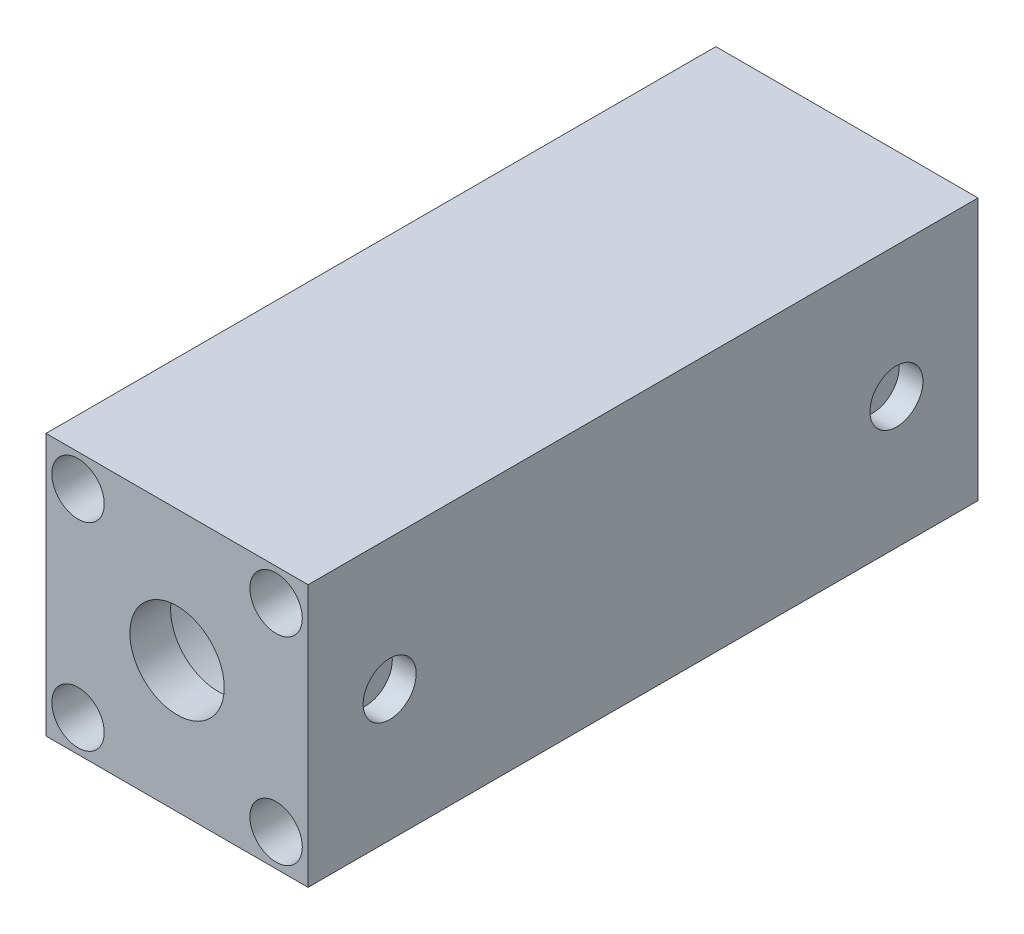
from build123d import *

# Parameters (mm, degrees)
SKETCH1_W                                      = 45
SKETCH1_H                                      = 45
SKETCH1_R                                      = 2.75
SKETCH1_R_2                                    = 16
SMC_45_MM_SQUARE_BODY_AND_FOUR_5_5_MM_TH_DEPTH = 115
SKETCH2_R                                      = 16
HEAD_END_CLEARANCE_ENVELOPE_DEPTH              = 7
ROD_START                                      = 108
SKETCH3_R                                      = 16
SKETCH3_R_2                                    = 8.1
ROD_COVER_AND_16_MM_ROD_CLEARANCE_DEPTH        = 7
SKETCH4_R                                      = 4.5
REAR_BOLT_HEAD_COUNTERBORES_DEPTH              = 7
FRONT_START                                    = 108
SKETCH5_R                                      = 4.5
FRONT_MOUNTING_COUNTERBORES_DEPTH              = 7
TOP_START                                      = 22.5
SKETCH6_R                                      = 4.55
TOP_RC_1_8_PORT_CLEARANCE_FOR_LAYOUT_DEPTH     = 4.1


with BuildPart() as part:
    # Sketch1 → SMC 45 mm square body and four 5.5 mm through holes (new body)
    with BuildSketch(Plane.XY):
        Rectangle(SKETCH1_W, SKETCH1_H)
        with Locations((-17, -17)):
            Circle(SKETCH1_R, mode=Mode.SUBTRACT)
        with Locations((-17, 17)):
            Circle(SKETCH1_R, mode=Mode.SUBTRACT)
        with Locations((17, -17)):
            Circle(SKETCH1_R, mode=Mode.SUBTRACT)
        with Locations((17, 17)):
            Circle(SKETCH1_R, mode=Mode.SUBTRACT)
        Circle(SKETCH1_R_2, mode=Mode.SUBTRACT)
    extrude(amount=SMC_45_MM_SQUARE_BODY_AND_FOUR_5_5_MM_TH_DEPTH)

    # Sketch2 → Head end clearance envelope (add)
    with BuildSketch(Plane.XY):
        Circle(SKETCH2_R)
    extrude(amount=HEAD_END_CLEARANCE_ENVELOPE_DEPTH)

    # Sketch3 → Rod cover and 16 mm rod clearance (add)
    with BuildSketch(Plane.XY.offset(ROD_START)):
        Circle(SKETCH3_R)
        Circle(SKETCH3_R_2, mode=Mode.SUBTRACT)
    extrude(amount=ROD_COVER_AND_16_MM_ROD_CLEARANCE_DEPTH)

    # Sketch4 → Rear bolt head counterbores (cut)
    with BuildSketch(Plane.XY):
        with Locations((-17, -17)):
            Circle(SKETCH4_R)
        with Locations((-17, 17)):
            Circle(SKETCH4_R)
        with Locations((17, -17)):
            Circle(SKETCH4_R)
        with Locations((17, 17)):
            Circle(SKETCH4_R)
    extrude(amount=REAR_BOLT_HEAD_COUNTERBORES_DEPTH, mode=Mode.SUBTRACT)

    # Sketch5 → Front mounting counterbores (cut)
    with BuildSketch(Plane.XY.offset(FRONT_START)):
        with Locations((-17, -17)):
            Circle(SKETCH5_R)
        with Locations((-17, 17)):
            Circle(SKETCH5_R)
        with Locations((17, -17)):
            Circle(SKETCH5_R)
        with Locations((17, 17)):
            Circle(SKETCH5_R)
    extrude(amount=FRONT_MOUNTING_COUNTERBORES_DEPTH, mode=Mode.SUBTRACT)

    # Sketch6 → Top Rc 1/8 port clearance for layout (cut)
    with BuildSketch(Plane(origin=(0, 0, 0), x_dir=(0, 0, -1), z_dir=(1, 0, 0)).offset(TOP_START)):
        with Locations((-14, 0)):
            Circle(SKETCH6_R)
        with Locations((-101, 0)):
            Circle(SKETCH6_R)
    extrude(amount=-TOP_RC_1_8_PORT_CLEARANCE_FOR_LAYOUT_DEPTH, mode=Mode.SUBTRACT)


solid = part.part
